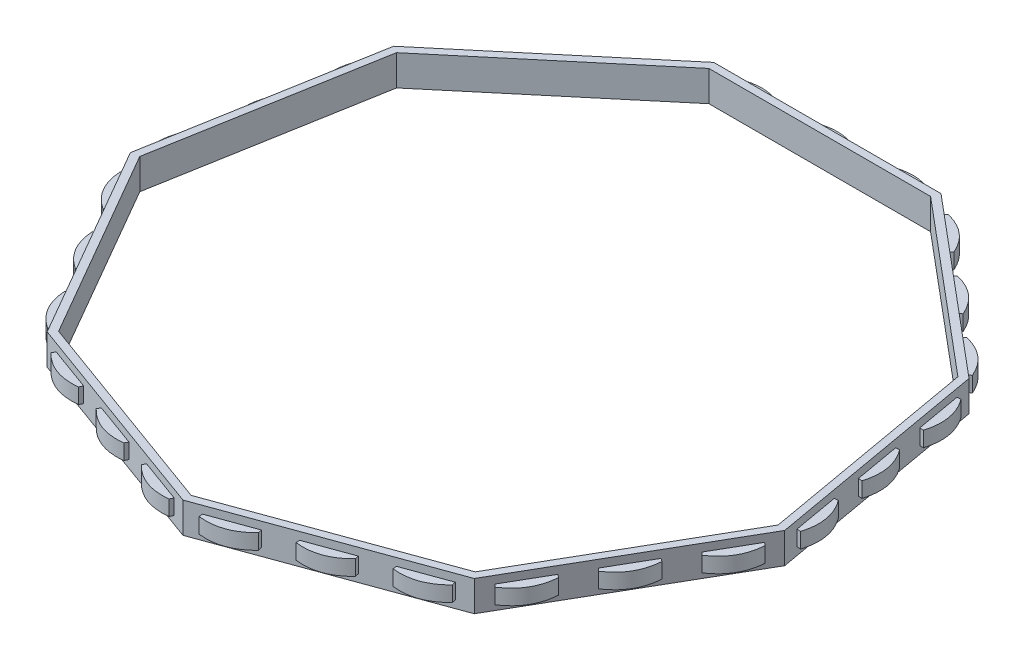
from build123d import *

# Parameters (mm, degrees)
RESSALTO_EXTRUS_O1_DEPTH = 4
RESSALTO_EXTRUS_O2_DEPTH = 2


with BuildPart() as part:
    # Esboço1 → Ressalto-extrusão1 (new, symmetric)
    with BuildSketch(Plane(origin=(0, 0, 0), x_dir=(1, 0, 0), z_dir=(0, 1, 0))):
        Polygon((90.042729598, -15.093270934), (79.718324222, 43.459341575), (34.172477019, 81.676845164), (-25.283403918, 81.676845164), (-70.82925112, 43.459341575), (-81.153656497, -15.093270934), (-51.425716028, -66.58357423), (4.444536551, -86.91868315), (60.31478913, -66.58357423), align=None)
        Polygon((-24.555463449, 79.676845164), (-68.98604115, 42.395163802), (-79.057635455, -14.723685872), (-50.057635455, -64.953159292), (4.444536551, -84.790327605), (58.946708556, -64.953159292), (87.946708556, -14.723685872), (77.875114252, 42.395163802), (33.444536551, 79.676845164), align=None, mode=Mode.SUBTRACT)
    extrude(amount=RESSALTO_EXTRUS_O1_DEPTH, both=True)

    # Esboço3 → Ressalto-extrusão2 (add, symmetric)
    with BuildSketch(Plane(origin=(0, 0, 0), x_dir=(1, 0, 0), z_dir=(0, 1, 0))):
        with BuildLine():
            Line((19.479618483, -81.446360856), (8.203307034, -85.550602576))
            Line((8.203307034, -85.550602576), (8.298757585, -86.546036749))
            add(Edge.make_bspline(
                [(19.712229138, -82.418930794), (15.032190048, -87.321803516), (8.298757585, -86.546036749)],
                knots=[0, 0, 0, 1, 1, 1], degree=2))
            Line((19.712229138, -82.418930794), (19.479618483, -81.446360856))
        make_face()
        with BuildLine():
            Line((38.076151521, -74.67777637), (26.799840071, -78.78201809))
            Line((26.799840071, -78.78201809), (26.895290622, -79.777452263))
            add(Edge.make_bspline(
                [(38.308762176, -75.650346308), (33.628723085, -80.55321903), (26.895290622, -79.777452263)],
                knots=[0, 0, 0, 1, 1, 1], degree=2))
            Line((38.308762176, -75.650346308), (38.076151521, -74.67777637))
        make_face()
        with BuildLine():
            Line((56.672684558, -67.909191884), (45.396373109, -72.013433604))
            Line((45.396373109, -72.013433604), (45.49182366, -73.008867777))
            add(Edge.make_bspline(
                [(56.905295213, -68.881761822), (52.225256123, -73.784634543), (45.49182366, -73.008867777)],
                knots=[0, 0, 0, 1, 1, 1], degree=2))
            Line((56.905295213, -68.881761822), (56.672684558, -67.909191884))
        make_face()
        with BuildLine():
            Line((-36.390634096, -72.055896523), (-47.666945545, -67.951654803))
            Line((-47.666945545, -67.951654803), (-48.233678933, -68.775556051))
            add(Edge.make_bspline(
                [(-36.837599901, -72.950447566), (-43.574223678, -73.69799483), (-48.233678933, -68.775556051)],
                knots=[0, 0, 0, 1, 1, 1], degree=2))
            Line((-36.837599901, -72.950447566), (-36.390634096, -72.055896523))
        make_face()
        with BuildLine():
            Line((-17.794101058, -78.824481009), (-29.070412508, -74.72023929))
            Line((-29.070412508, -74.72023929), (-29.637145896, -75.544140538))
            add(Edge.make_bspline(
                [(-18.241066864, -79.719032052), (-24.97769064, -80.466579316), (-29.637145896, -75.544140538)],
                knots=[0, 0, 0, 1, 1, 1], degree=2))
            Line((-18.241066864, -79.719032052), (-17.794101058, -78.824481009))
        make_face()
        with BuildLine():
            Line((0.802431979, -85.593065496), (-10.47387947, -81.488823776))
            Line((-10.47387947, -81.488823776), (-11.040612858, -82.312725024))
            add(Edge.make_bspline(
                [(0.355466174, -86.487616539), (-6.381157603, -87.235163803), (-11.040612858, -82.312725024)],
                knots=[0, 0, 0, 1, 1, 1], degree=2))
            Line((0.355466174, -86.487616539), (0.802431979, -85.593065496))
        make_face()
        with BuildLine():
            Line((-73.153656497, -28.949677395), (-79.153656497, -18.557372549))
            Line((-79.153656497, -18.557372549), (-80.117392973, -18.824228322))
            add(Edge.make_bspline(
                [(-74.071058495, -29.347639168), (-79.712125823, -25.590075301), (-80.117392973, -18.824228322)],
                knots=[0, 0, 0, 1, 1, 1], degree=2))
            Line((-74.071058495, -29.347639168), (-73.153656497, -28.949677395))
        make_face()
        with BuildLine():
            Line((-63.258647945, -46.088334948), (-69.258647945, -35.696030102))
            Line((-69.258647945, -35.696030102), (-70.222384422, -35.962885875))
            add(Edge.make_bspline(
                [(-64.176049943, -46.486296721), (-69.817117271, -42.728732854), (-70.222384422, -35.962885875)],
                knots=[0, 0, 0, 1, 1, 1], degree=2))
            Line((-64.176049943, -46.486296721), (-63.258647945, -46.088334948))
        make_face()
        with BuildLine():
            Line((-53.363639393, -63.226992501), (-59.363639393, -52.834687655))
            Line((-59.363639393, -52.834687655), (-60.32737587, -53.101543428))
            add(Edge.make_bspline(
                [(-54.281041392, -63.624954274), (-59.92210872, -59.867390408), (-60.32737587, -53.101543428)],
                knots=[0, 0, 0, 1, 1, 1], degree=2))
            Line((-54.281041392, -63.624954274), (-53.363639393, -63.226992501))
        make_face()
        with BuildLine():
            Line((-73.607621963, 27.702417527), (-71.523843831, 39.520110563))
            Line((-71.523843831, 39.520110563), (-72.433640388, 39.935165047))
            add(Edge.make_bspline(
                [(-74.566197563, 27.987255759), (-76.472190347, 34.491724863), (-72.433640388, 39.935165047)],
                knots=[0, 0, 0, 1, 1, 1], degree=2))
            Line((-74.566197563, 27.987255759), (-73.607621963, 27.702417527))
        make_face()
        with BuildLine():
            Line((-77.044122369, 8.213055251), (-74.960344237, 20.030748287))
            Line((-74.960344237, 20.030748287), (-75.870140794, 20.445802771))
            add(Edge.make_bspline(
                [(-78.002697969, 8.497893483), (-79.908690753, 15.002362587), (-75.870140794, 20.445802771)],
                knots=[0, 0, 0, 1, 1, 1], degree=2))
            Line((-78.002697969, 8.497893483), (-77.044122369, 8.213055251))
        make_face()
        with BuildLine():
            Line((-80.480622775, -11.276307025), (-78.396844643, 0.541386011))
            Line((-78.396844643, 0.541386011), (-79.3066412, 0.956440495))
            add(Edge.make_bspline(
                [(-81.439198375, -10.991468793), (-83.345191159, -4.486999689), (-79.3066412, 0.956440495)],
                knots=[0, 0, 0, 1, 1, 1], degree=2))
            Line((-81.439198375, -10.991468793), (-80.480622775, -11.276307025))
        make_face()
        with BuildLine():
            Line((-37.540115008, 71.392243409), (-28.34758169, 79.105694725))
            Line((-28.34758169, 79.105694725), (-28.777734407, 80.008450861))
            add(Edge.make_bspline(
                [(-38.091336033, 72.226602673), (-35.370419066, 78.434463631), (-28.777734407, 80.008450861)],
                knots=[0, 0, 0, 1, 1, 1], degree=2))
            Line((-38.091336033, 72.226602673), (-37.540115008, 71.392243409))
        make_face()
        with BuildLine():
            Line((-52.700147639, 58.67146562), (-43.507614322, 66.384916936))
            Line((-43.507614322, 66.384916936), (-43.937767039, 67.287673071))
            add(Edge.make_bspline(
                [(-53.251368664, 59.505824883), (-50.530451698, 65.713685841), (-43.937767039, 67.287673071)],
                knots=[0, 0, 0, 1, 1, 1], degree=2))
            Line((-53.251368664, 59.505824883), (-52.700147639, 58.67146562))
        make_face()
        with BuildLine():
            Line((-67.860180271, 45.95068783), (-58.667646953, 53.664139146))
            Line((-58.667646953, 53.664139146), (-59.09779967, 54.566895282))
            add(Edge.make_bspline(
                [(-68.411401296, 46.785047094), (-65.690484329, 52.992908052), (-59.09779967, 54.566895282)],
                knots=[0, 0, 0, 1, 1, 1], degree=2))
            Line((-68.411401296, 46.785047094), (-67.860180271, 45.95068783))
        make_face()
        with BuildLine():
            Line((18.172477019, 81.676845164), (30.172477019, 81.676845164))
            Line((30.172477019, 81.676845164), (30.423241379, 82.644893322))
            add(Edge.make_bspline(
                [(18.286533013, 82.670319487), (24.361212442, 85.676845164), (30.423241379, 82.644893322)],
                knots=[0, 0, 0, 1, 1, 1], degree=2))
            Line((18.286533013, 82.670319487), (18.172477019, 81.676845164))
        make_face()
        with BuildLine():
            Line((-1.617540084, 81.676845164), (10.382459916, 81.676845164))
            Line((10.382459916, 81.676845164), (10.633224276, 82.644893322))
            add(Edge.make_bspline(
                [(-1.503484091, 82.670319487), (4.571195338, 85.676845164), (10.633224276, 82.644893322)],
                knots=[0, 0, 0, 1, 1, 1], degree=2))
            Line((-1.503484091, 82.670319487), (-1.617540084, 81.676845164))
        make_face()
        with BuildLine():
            Line((-21.407557188, 81.676845164), (-9.407557188, 81.676845164))
            Line((-9.407557188, 81.676845164), (-9.156792828, 82.644893322))
            add(Edge.make_bspline(
                [(-21.293501194, 82.670319487), (-15.218821765, 85.676845164), (-9.156792828, 82.644893322)],
                knots=[0, 0, 0, 1, 1, 1], degree=2))
            Line((-21.293501194, 82.670319487), (-21.407557188, 81.676845164))
        make_face()
        with BuildLine():
            Line((67.461613132, 53.74394333), (76.654146449, 46.030492014))
            Line((76.654146449, 46.030492014), (77.468492455, 46.610871702))
            add(Edge.make_bspline(
                [(68.187578077, 54.431675035), (74.773609951, 52.830078653), (77.468492455, 46.610871702)],
                knots=[0, 0, 0, 1, 1, 1], degree=2))
            Line((68.187578077, 54.431675035), (67.461613132, 53.74394333))
        make_face()
        with BuildLine():
            Line((52.3015805, 66.46472112), (61.494113818, 58.751269803))
            Line((61.494113818, 58.751269803), (62.308459824, 59.331649492))
            add(Edge.make_bspline(
                [(53.027545446, 67.152452825), (59.61357732, 65.550856443), (62.308459824, 59.331649492)],
                knots=[0, 0, 0, 1, 1, 1], degree=2))
            Line((53.027545446, 67.152452825), (52.3015805, 66.46472112))
        make_face()
        with BuildLine():
            Line((37.141547869, 79.185498909), (46.334081186, 71.472047593))
            Line((46.334081186, 71.472047593), (47.148427192, 72.052427281))
            add(Edge.make_bspline(
                [(37.867512814, 79.873230614), (44.453544688, 78.271634232), (47.148427192, 72.052427281)],
                knots=[0, 0, 0, 1, 1, 1], degree=2))
            Line((37.867512814, 79.873230614), (37.141547869, 79.185498909))
        make_face()
        with BuildLine():
            Line((87.264358755, 0.663653114), (89.348136887, -11.154039922))
            Line((89.348136887, -11.154039922), (90.345022993, -11.23289481))
            add(Edge.make_bspline(
                [(88.262545586, 0.723844893), (92.278252396, -4.736468801), (90.345022993, -11.23289481)],
                knots=[0, 0, 0, 1, 1, 1], degree=2))
            Line((88.262545586, 0.723844893), (87.264358755, 0.663653114))
        make_face()
        with BuildLine():
            Line((83.827858349, 20.15301539), (85.911636481, 8.335322354))
            Line((85.911636481, 8.335322354), (86.908522587, 8.256467466))
            add(Edge.make_bspline(
                [(84.82604518, 20.213207169), (88.84175199, 14.752893475), (86.908522587, 8.256467466)],
                knots=[0, 0, 0, 1, 1, 1], degree=2))
            Line((84.82604518, 20.213207169), (83.827858349, 20.15301539))
        make_face()
        with BuildLine():
            Line((80.391357943, 39.642377666), (82.475136075, 27.82468463))
            Line((82.475136075, 27.82468463), (83.472022181, 27.745829742))
            add(Edge.make_bspline(
                [(81.389544774, 39.702569445), (85.405251584, 34.242255751), (83.472022181, 27.745829742)],
                knots=[0, 0, 0, 1, 1, 1], degree=2))
            Line((81.389544774, 39.702569445), (80.391357943, 39.642377666))
        make_face()
        with BuildLine():
            Line((68.31478913, -52.727167769), (62.31478913, -63.119472615))
            Line((62.31478913, -63.119472615), (63.027761246, -63.820665))
            add(Edge.make_bspline(
                [(69.118135134, -53.322680319), (68.684523033, -60.086769863), (63.027761246, -63.820665)],
                knots=[0, 0, 0, 1, 1, 1], degree=2))
            Line((69.118135134, -53.322680319), (68.31478913, -52.727167769))
        make_face()
        with BuildLine():
            Line((78.209797681, -35.588510216), (72.209797681, -45.980815062))
            Line((72.209797681, -45.980815062), (72.922769798, -46.682007447))
            add(Edge.make_bspline(
                [(79.013143686, -36.184022766), (78.579531585, -42.94811231), (72.922769798, -46.682007447)],
                knots=[0, 0, 0, 1, 1, 1], degree=2))
            Line((79.013143686, -36.184022766), (78.209797681, -35.588510216))
        make_face()
        with BuildLine():
            Line((88.104806233, -18.449852663), (82.104806233, -28.842157509))
            Line((82.104806233, -28.842157509), (82.81777835, -29.543349894))
            add(Edge.make_bspline(
                [(88.908152238, -19.045365213), (88.474540137, -25.809454757), (82.81777835, -29.543349894)],
                knots=[0, 0, 0, 1, 1, 1], degree=2))
            Line((88.908152238, -19.045365213), (88.104806233, -18.449852663))
        make_face()
    extrude(amount=RESSALTO_EXTRUS_O2_DEPTH, both=True)


solid = part.part
